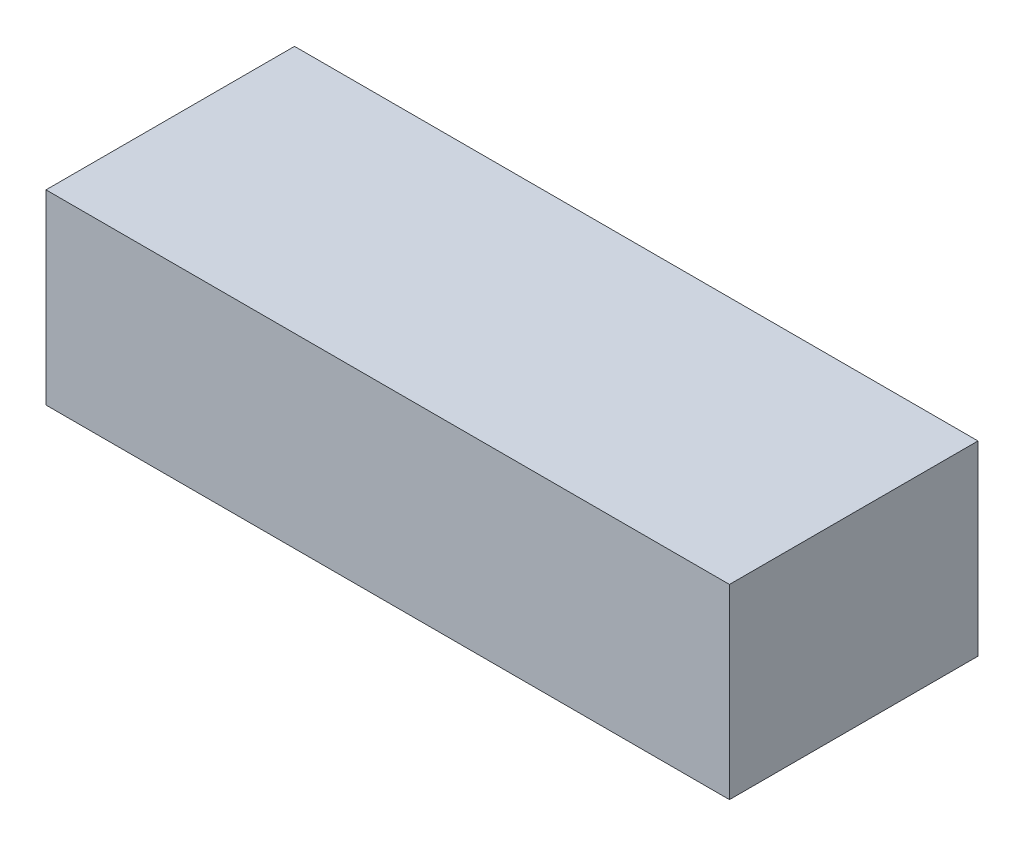
from build123d import *

# Parameters (mm, degrees)
SKETCH_1_W      = 44
SKETCH_1_H      = 12
EXTRUDE_1_DEPTH = 8


with BuildPart() as part:
    # 草图1 → 凸台-拉伸1 (new, symmetric)
    with BuildSketch(Plane.XY):
        Rectangle(SKETCH_1_W, SKETCH_1_H)
    extrude(amount=EXTRUDE_1_DEPTH, both=True)


solid = part.part
